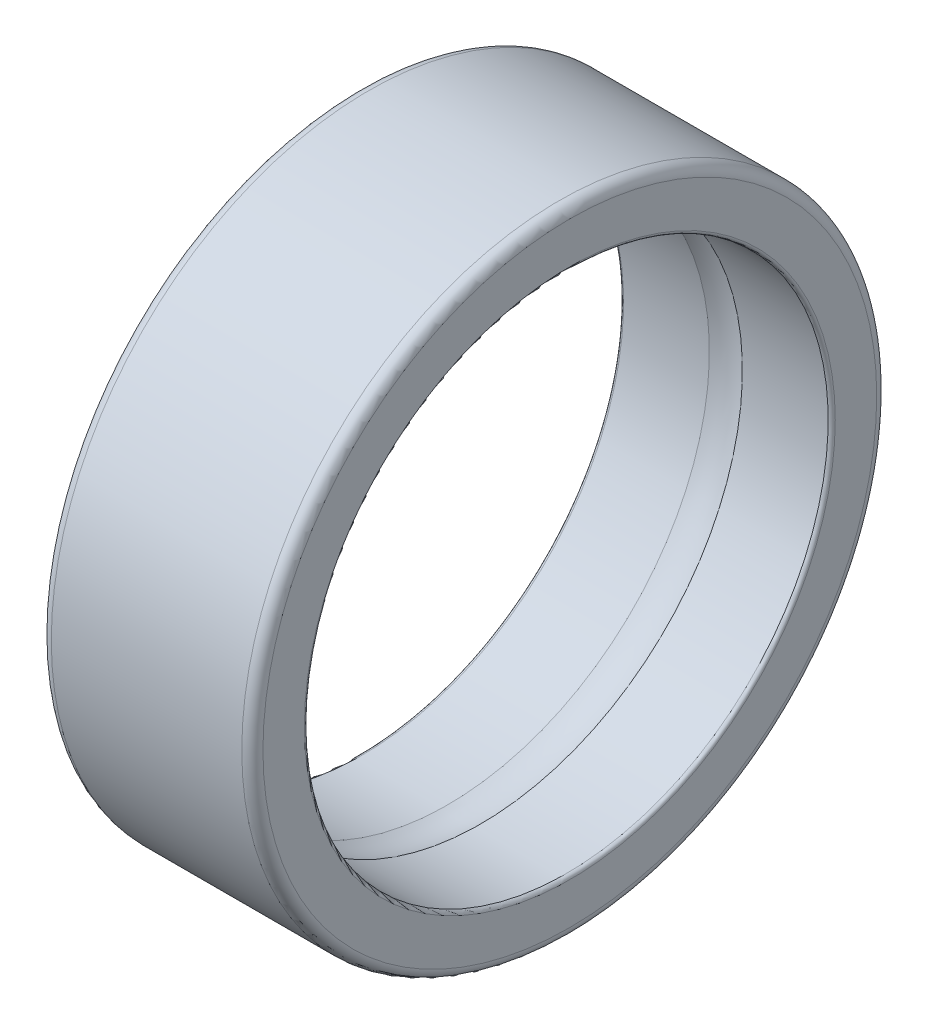
from build123d import *


with BuildPart() as part:
    # Sketch1 → Revolve1 (revolve)
    with BuildSketch(Plane.XY, mode=Mode.PRIVATE) as revolve1_sk:
        with BuildLine():
            Line((0.066666667, 4.95), (1.6877501, 4.95))
            ThreePointArc((1.6877501, 4.95), (2, 5), (2.3122499, 4.95))
            Line((2.3122499, 4.95), (3.933333333, 4.95))
            ThreePointArc((3.933333333, 4.95), (3.980473785, 4.969526215), (4, 5.016666667))
            Line((4, 5.016666667), (4, 5.8))
            ThreePointArc((4, 5.8), (3.941421356, 5.941421356), (3.8, 6))
            Line((3.8, 6), (0.2, 6))
            ThreePointArc((0.2, 6), (0.058578644, 5.941421356), (0, 5.8))
            Line((0, 5.8), (0, 5.016666667))
            ThreePointArc((0, 5.016666667), (0.019526215, 4.969526215), (0.066666667, 4.95))
        make_face()
    revolve(revolve1_sk.sketch.rotate(Axis((4, 0, 0), (-1, 0, 0)), 270), axis=Axis((4, 0, 0), (-1, 0, 0)))


solid = part.part
